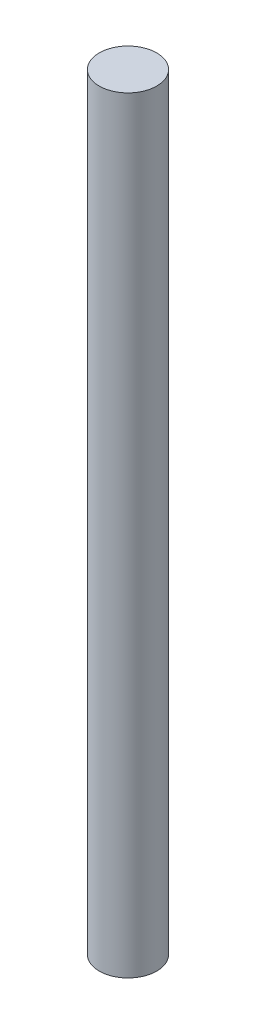
from build123d import *

# Parameters (mm, degrees)
SKETCH1_R           = 1.5
BOSS_EXTRUDE1_DEPTH = 40


with BuildPart() as part:
    # Sketch1 → Boss-Extrude1 (new body)
    with BuildSketch(Plane(origin=(0, 0, 0), x_dir=(1, 0, 0), z_dir=(0, 1, 0))):
        with Locations(Location((0, 0, 0), (0, 0, 270))):
            Circle(SKETCH1_R)
    extrude(amount=BOSS_EXTRUDE1_DEPTH)


solid = part.part
